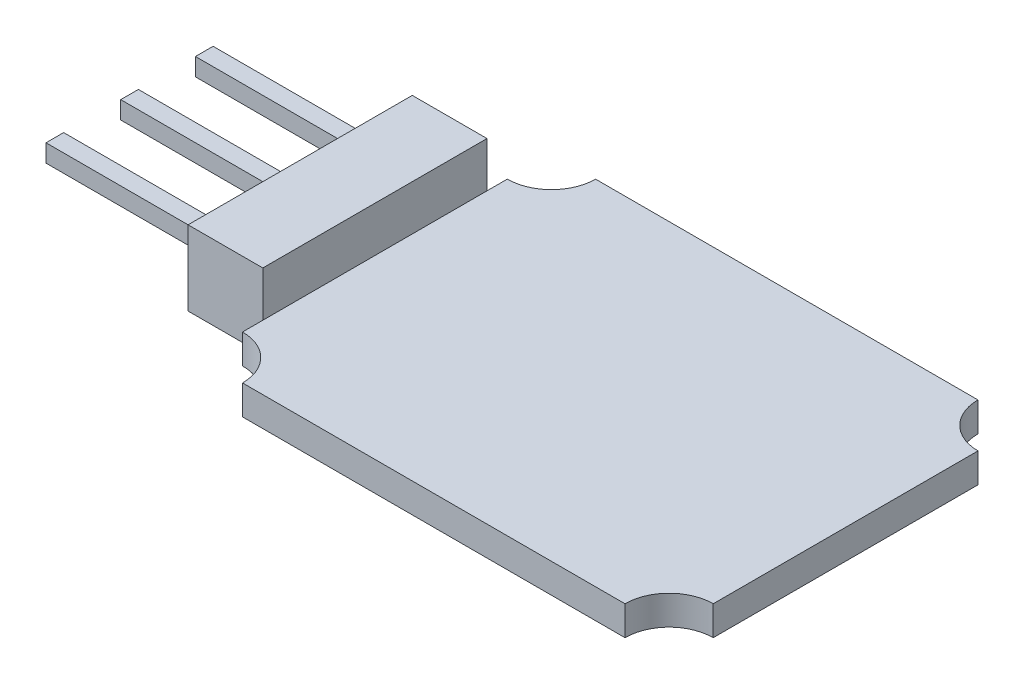
from build123d import *

# Parameters (mm, degrees)
BOSS_EXTRU_1_DEPTH = 1
ESQUISSE2_W        = 2.54
ESQUISSE2_H        = 2.54
BOSS_EXTRU_2_DEPTH = 3.81
ESQUISSE3_W        = 0.6
ESQUISSE3_H        = 0.6
BOSS_EXTRU_3_DEPTH = 6
CHANFREIN1_SIZE    = 0.2


with BuildPart() as part:
    # Esquisse1 → Boss.-Extru.1 (new body)
    with BuildSketch(Plane(origin=(0, 0, 0), x_dir=(1, 0, 0), z_dir=(0, 1, 0))):
        with BuildLine():
            Line((-6.5, -6), (6.5, -6))
            ThreePointArc((6.5, -6), (6.939339828, -4.939339828), (8, -4.5))
            Line((8, -4.5), (8, 4.5))
            ThreePointArc((8, 4.5), (6.939339828, 4.939339828), (6.5, 6))
            Line((6.5, 6), (-6.5, 6))
            ThreePointArc((-6.5, 6), (-6.939339828, 4.939339828), (-8, 4.5))
            Line((-8, 4.5), (-8, -4.5))
            ThreePointArc((-8, -4.5), (-6.939339828, -4.939339828), (-6.5, -6))
        make_face()
    extrude(amount=BOSS_EXTRU_1_DEPTH)

    # Esquisse2 → Boss.-Extru.2 (add, symmetric)
    with BuildSketch(Plane(origin=(0, 0, 0), x_dir=(-1, 0, 0), z_dir=(0, 0, -1))):
        with Locations((9.27, 1.27)):
            Rectangle(ESQUISSE2_W, ESQUISSE2_H)
    extrude(amount=BOSS_EXTRU_2_DEPTH, both=True)

    # Esquisse3 → Boss.-Extru.3 (add)
    with BuildSketch(Plane.ZY.offset(10.54)):
        with Locations((-2.54, 1.27)):
            Rectangle(ESQUISSE3_W, ESQUISSE3_H)
        with Locations((0, 1.27)):
            Rectangle(ESQUISSE3_W, ESQUISSE3_H)
        with Locations((2.54, 1.27)):
            Rectangle(ESQUISSE3_W, ESQUISSE3_H)
    extrude(amount=BOSS_EXTRU_3_DEPTH)

    # Chanfrein1
    chanfrein1_edges = [part.edges().sort_by_distance(p)[0] for p in [
        (-16.54, 1.27, -2.84),
        (-16.54, 0.97, -2.54),
        (-16.54, 1.27, -2.24),
        (-16.54, 1.57, -2.54),
        (-16.54, 1.27, -0.3),
        (-16.54, 0.97, 0),
        (-16.54, 1.27, 0.3),
        (-16.54, 1.57, 0),
        (-16.54, 1.27, 2.24),
        (-16.54, 0.97, 2.54),
        (-16.54, 1.27, 2.84),
        (-16.54, 1.57, 2.54),
    ]]
    chamfer(chanfrein1_edges, length=CHANFREIN1_SIZE)


solid = part.part
